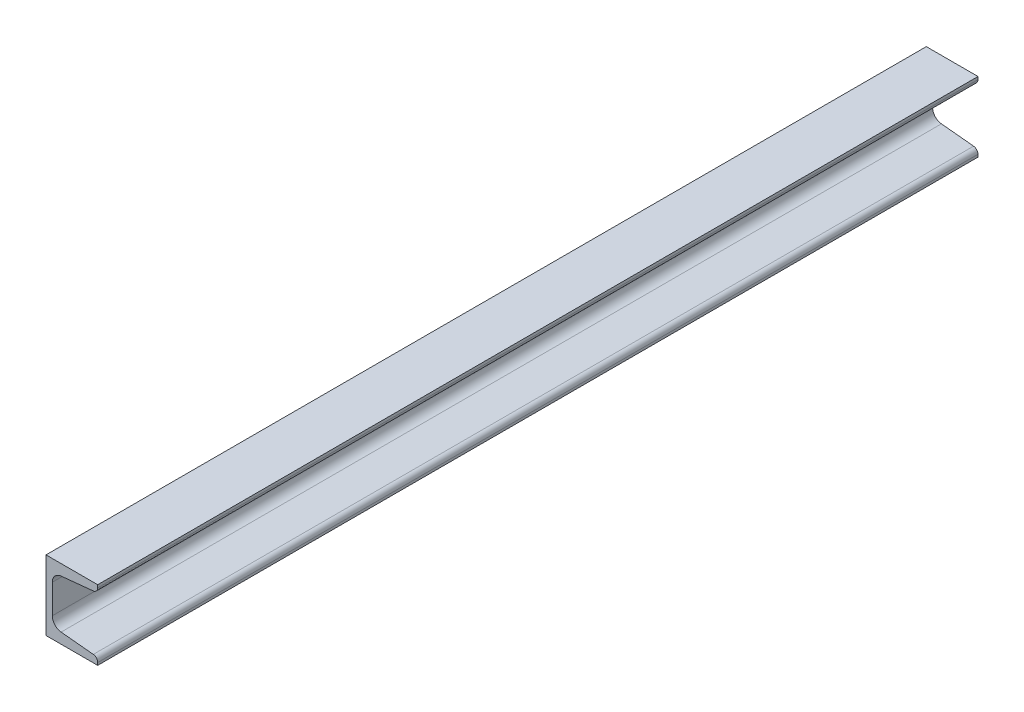
from build123d import *

# Parameters (mm, degrees)
EXTRUDE_1_DEPTH = 630


with BuildPart() as part:
    # 草图1 → 凸台-拉伸1 (new body)
    with BuildSketch(Plane.XY):
        with BuildLine():
            Line((0, 0), (0, 50))
            Line((0, 50), (37, 50))
            Line((37, 50), (37, 48.040012398))
            ThreePointArc((37, 48.040012398), (36.095083867, 45.691493776), (33.848263017, 44.557382233))
            Line((33.848263017, 44.557382233), (10.803473967, 42.252903328))
            ThreePointArc((10.803473967, 42.252903328), (6.309832265, 39.984680242), (4.5, 35.287642996))
            Line((4.5, 35.287642996), (4.5, 14.509912935))
            ThreePointArc((4.5, 14.509912935), (6.309832265, 9.812875689), (10.803473967, 7.544652603))
            Line((10.803473967, 7.544652603), (33.848263017, 5.240173698))
            ThreePointArc((33.848263017, 5.240173698), (36.095083867, 4.106062155), (37, 1.757543533))
            Line((37, 1.757543533), (37, 0))
            Line((37, 0), (0, 0))
        make_face()
    extrude(amount=EXTRUDE_1_DEPTH)


solid = part.part
